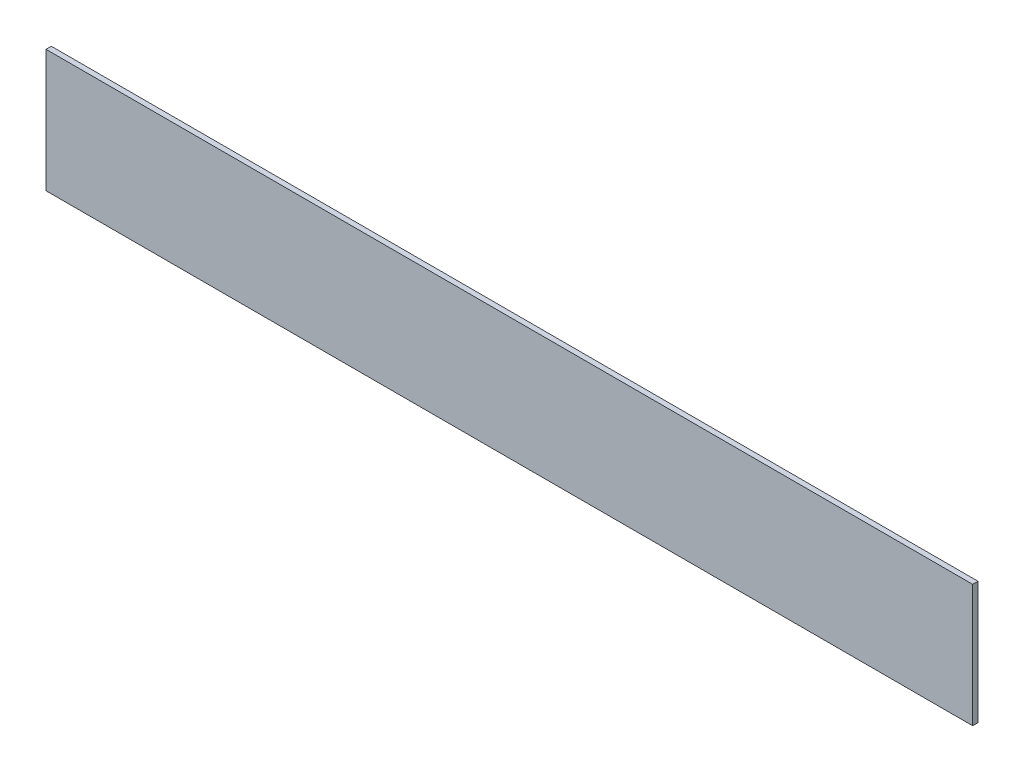
from build123d import *

# Parameters (mm, degrees)
SKETCH1_W           = 552.45
SKETCH1_H           = 73.025
BOSS_EXTRUDE1_DEPTH = 3.175


with BuildPart() as part:
    # Sketch1 → Boss-Extrude1 (new body)
    with BuildSketch(Plane.XY):
        Rectangle(SKETCH1_W, SKETCH1_H)
    extrude(amount=BOSS_EXTRUDE1_DEPTH)


solid = part.part
